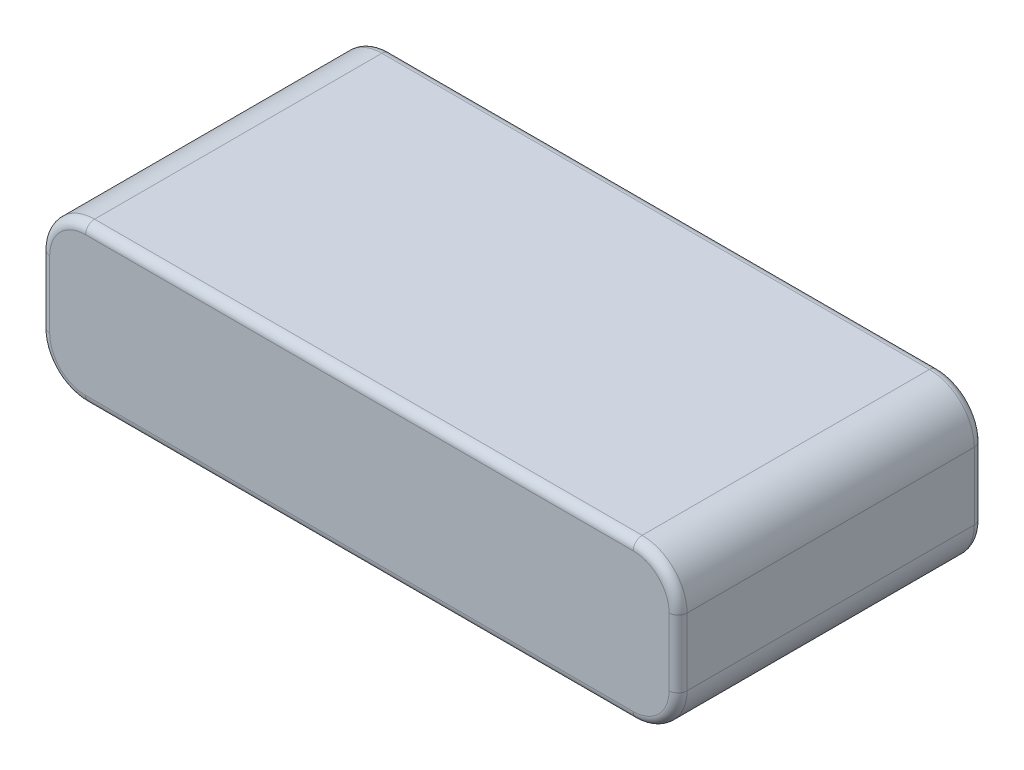
from build123d import *

# Parameters (mm, degrees)
SKETCH1_W           = 71
SKETCH1_H           = 34
BOSS_EXTRUDE1_DEPTH = 17.5
FILLET2_R           = 5
FILLET3_R           = 1


with BuildPart() as part:
    # Sketch1 → Boss-Extrude1 (new body)
    with BuildSketch(Plane(origin=(0, 0, 0), x_dir=(1, 0, 0), z_dir=(0, 1, 0))):
        Rectangle(SKETCH1_W, SKETCH1_H)
    extrude(amount=BOSS_EXTRUDE1_DEPTH)

    # Fillet2
    fillet2_edges = [part.edges().sort_by_distance(p)[0] for p in [
        (-35.5, 17.5, 0),
        (35.5, 17.5, 0),
        (-35.5, 0, 0),
        (35.5, 0, 0),
    ]]
    fillet(fillet2_edges, radius=FILLET2_R)

    # Fillet3
    fillet3_edges = [part.edges().sort_by_distance(p)[0] for p in [
        (-35.5, 8.75, 17),
        (-35.5, 8.75, -17),
        (0, 0, 17),
        (35.5, 8.75, 17),
        (0, 17.5, 17),
        (-34.035533906, 16.035533906, 17),
        (34.035533906, 16.035533906, 17),
        (34.035533906, 1.464466094, 17),
        (-34.035533906, 1.464466094, 17),
        (0, 0, -17),
        (0, 17.5, -17),
        (35.5, 8.75, -17),
        (-34.035533906, 16.035533906, -17),
        (34.035533906, 16.035533906, -17),
        (34.035533906, 1.464466094, -17),
        (-34.035533906, 1.464466094, -17),
    ]]
    fillet(fillet3_edges, radius=FILLET3_R)


solid = part.part
